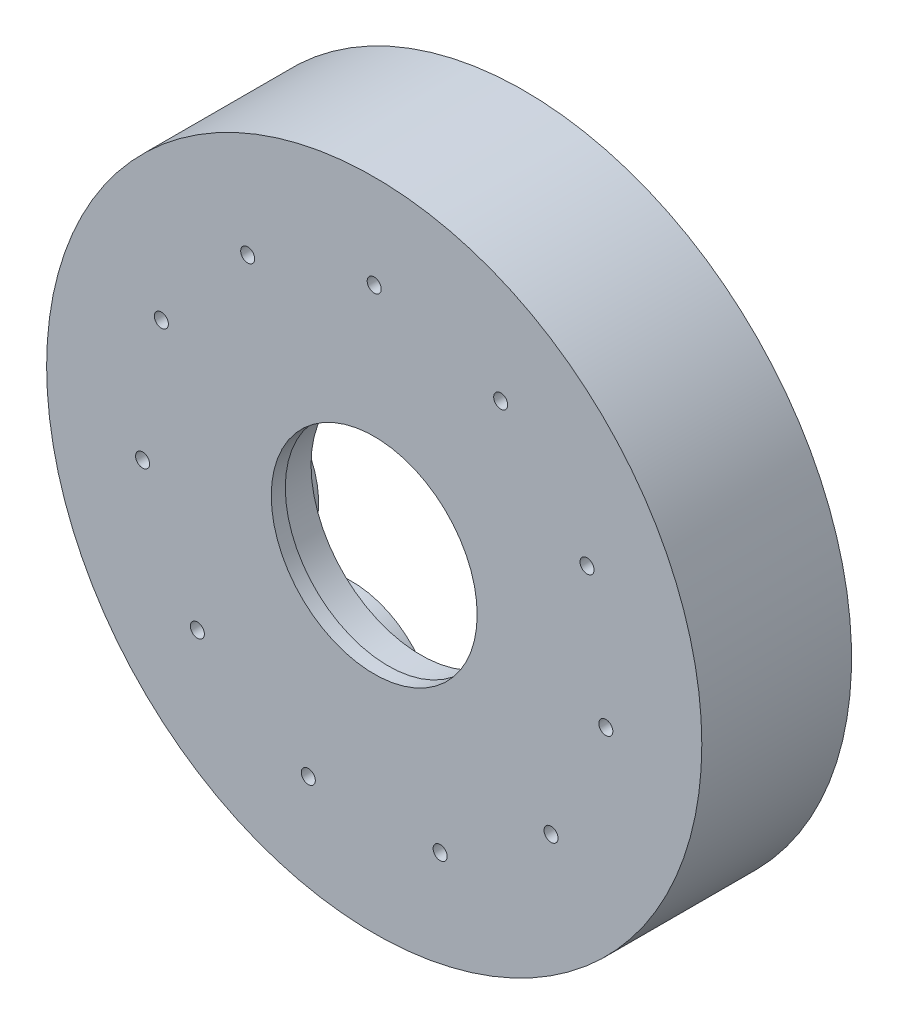
from build123d import *

# Parameters (mm, degrees)
SKETCH1_R           = 70
BOSS_EXTRUDE2_DEPTH = 25
SKETCH3_R           = 70
BOSS_EXTRUDE3_DEPTH = 10
SKETCH4_R           = 3
CUT_EXTRUDE1_DEPTH  = 4
SKETCH5_R           = 23.5
CUT_EXTRUDE2_DEPTH  = 7
SKETCH6_R           = 1.5
CUT_EXTRUDE3_DEPTH  = 7
SKETCH7_R           = 22
CUT_EXTRUDE4_DEPTH  = 7
SKETCH8_R           = 70
CUT_EXTRUDE5_DEPTH  = 3
SKETCH9_R           = 1.425
CUT_EXTRUDE6_DEPTH  = 20


with BuildPart() as part:
    # Sketch1 → Boss-Extrude2 (new body)
    with BuildSketch(Plane.XY):
        Circle(SKETCH1_R)
        with BuildLine():
            ThreePointArc((5.084181722, 54.049826689), (0, 56.5), (-5.084181722, 54.049826689))
            ThreePointArc((-5.084181722, 54.049826689), (-14.092268161, 47.993857843), (-24.944456649, 48.218323814))
            ThreePointArc((-24.944456649, 48.218323814), (-30.546206186, 47.530824605), (-33.49862832, 42.720891489))
            ThreePointArc((-33.49862832, 42.720891489), (-37.802608913, 32.756147086), (-47.053406284, 27.077843822))
            ThreePointArc((-47.053406284, 27.077843822), (-51.394207738, 23.470948235), (-51.277497116, 17.828375092))
            ThreePointArc((-51.277497116, 17.828375092), (-49.510888436, 7.118591073), (-54.223231887, -2.659660261))
            ThreePointArc((-54.223231887, -2.659660261), (-55.924911466, -8.040788362), (-52.776122888, -12.724524427))
            ThreePointArc((-52.776122888, -12.724524427), (-45.499810707, -20.779067307), (-44.177564489, -31.552741003))
            ThreePointArc((-44.177564489, -31.552741003), (-42.699850951, -36.999631468), (-37.51870254, -39.237477348))
            ThreePointArc((-37.51870254, -39.237477348), (-27.042864565, -42.079518636), (-20.105832509, -50.428049418))
            ThreePointArc((-20.105832509, -50.428049418), (-15.917889462, -54.211353009), (-10.349359231, -53.29280845))
            ThreePointArc((-10.349359231, -53.29280845), (0, -50.020020118), (10.349359231, -53.29280845))
            ThreePointArc((10.349359231, -53.29280845), (15.917889462, -54.211353009), (20.105832509, -50.428049418))
            ThreePointArc((20.105832509, -50.428049418), (27.042864565, -42.079518636), (37.51870254, -39.237477348))
            ThreePointArc((37.51870254, -39.237477348), (42.699850951, -36.999631468), (44.177564489, -31.552741003))
            ThreePointArc((44.177564489, -31.552741003), (45.499810707, -20.779067307), (52.776122888, -12.724524427))
            ThreePointArc((52.776122888, -12.724524427), (55.924911466, -8.040788362), (54.223231887, -2.659660261))
            ThreePointArc((54.223231887, -2.659660261), (49.510888436, 7.118591073), (51.277497116, 17.828375092))
            ThreePointArc((51.277497116, 17.828375092), (51.394207738, 23.470948235), (47.053406284, 27.077843822))
            ThreePointArc((47.053406284, 27.077843822), (37.802608913, 32.756147086), (33.49862832, 42.720891489))
            ThreePointArc((33.49862832, 42.720891489), (30.546206186, 47.530824605), (24.944456649, 48.218323814))
            ThreePointArc((24.944456649, 48.218323814), (14.092268161, 47.993857843), (5.084181722, 54.049826689))
        make_face(mode=Mode.SUBTRACT)
    extrude(amount=BOSS_EXTRUDE2_DEPTH)

    # Sketch3 → Boss-Extrude3 (add)
    with BuildSketch(Plane.XY.offset(25)):
        Circle(SKETCH3_R)
    extrude(amount=BOSS_EXTRUDE3_DEPTH)

    # Sketch4 → Cut-Extrude1 (cut)
    with BuildSketch(Plane(origin=(0, 0, 25), x_dir=(-1, 0, 0), z_dir=(0, 0, -1))):
        with Locations((0, 50)):
            Circle(SKETCH4_R)
        with Locations((27.032040873, 42.062676642)):
            Circle(SKETCH4_R)
        with Locations((45.481599768, 20.77075065)):
            Circle(SKETCH4_R)
        with Locations((49.491072094, -7.115741914)):
            Circle(SKETCH4_R)
        with Locations((37.787478718, -32.743036697)):
            Circle(SKETCH4_R)
        with Locations((14.086627842, -47.974648681)):
            Circle(SKETCH4_R)
        with Locations((-14.086627842, -47.974648681)):
            Circle(SKETCH4_R)
        with Locations((-37.787478718, -32.743036697)):
            Circle(SKETCH4_R)
        with Locations((-49.491072094, -7.115741914)):
            Circle(SKETCH4_R)
        with Locations((-45.481599768, 20.77075065)):
            Circle(SKETCH4_R)
        with Locations((-27.032040873, 42.062676642)):
            Circle(SKETCH4_R)
    extrude(amount=-CUT_EXTRUDE1_DEPTH, mode=Mode.SUBTRACT)

    # Sketch5 → Cut-Extrude2 (cut)
    with BuildSketch(Plane(origin=(0, 0, 25), x_dir=(-1, 0, 0), z_dir=(0, 0, -1))):
        Circle(SKETCH5_R)
    extrude(amount=-CUT_EXTRUDE2_DEPTH, mode=Mode.SUBTRACT)

    # Sketch6 → Cut-Extrude3 (cut)
    with BuildSketch(Plane(origin=(0, 0, 29), x_dir=(-1, 0, 0), z_dir=(0, 0, -1))):
        with Locations((0, 50)):
            Circle(SKETCH6_R)
        with Locations((27.032040873, 42.062676642)):
            Circle(SKETCH6_R)
        with Locations((45.481599768, 20.77075065)):
            Circle(SKETCH6_R)
        with Locations((49.491072094, -7.115741914)):
            Circle(SKETCH6_R)
        with Locations((37.787478718, -32.743036697)):
            Circle(SKETCH6_R)
        with Locations((14.086627842, -47.974648681)):
            Circle(SKETCH6_R)
        with Locations((-14.086627842, -47.974648681)):
            Circle(SKETCH6_R)
        with Locations((-37.787478718, -32.743036697)):
            Circle(SKETCH6_R)
        with Locations((-49.491072094, -7.115741914)):
            Circle(SKETCH6_R)
        with Locations((-45.481599768, 20.77075065)):
            Circle(SKETCH6_R)
        with Locations((-27.032040873, 42.062676642)):
            Circle(SKETCH6_R)
    extrude(amount=-CUT_EXTRUDE3_DEPTH, mode=Mode.SUBTRACT)

    # Sketch7 → Cut-Extrude4 (cut)
    with BuildSketch(Plane(origin=(0, 0, 32), x_dir=(-1, 0, 0), z_dir=(0, 0, -1))):
        Circle(SKETCH7_R)
    extrude(amount=-CUT_EXTRUDE4_DEPTH, mode=Mode.SUBTRACT)

    # Sketch8 → Cut-Extrude5 (cut)
    with BuildSketch(Plane(origin=(0, 0, 0), x_dir=(-1, 0, 0), z_dir=(0, 0, -1))):
        Circle(SKETCH8_R)
    extrude(amount=-CUT_EXTRUDE5_DEPTH, mode=Mode.SUBTRACT)

    # Sketch9 → Cut-Extrude6 (cut)
    with BuildSketch(Plane(origin=(0, 0, 3), x_dir=(-1, 0, 0), z_dir=(0, 0, -1))):
        with Locations((0, 64)):
            Circle(SKETCH9_R)
        with Locations((55.425625842, 32)):
            Circle(SKETCH9_R)
        with Locations((55.425625842, -32)):
            Circle(SKETCH9_R)
        with Locations((0, -64)):
            Circle(SKETCH9_R)
        with Locations((-55.425625842, -32)):
            Circle(SKETCH9_R)
        with Locations((-55.425625842, 32)):
            Circle(SKETCH9_R)
    extrude(amount=-CUT_EXTRUDE6_DEPTH, mode=Mode.SUBTRACT)


solid = part.part
